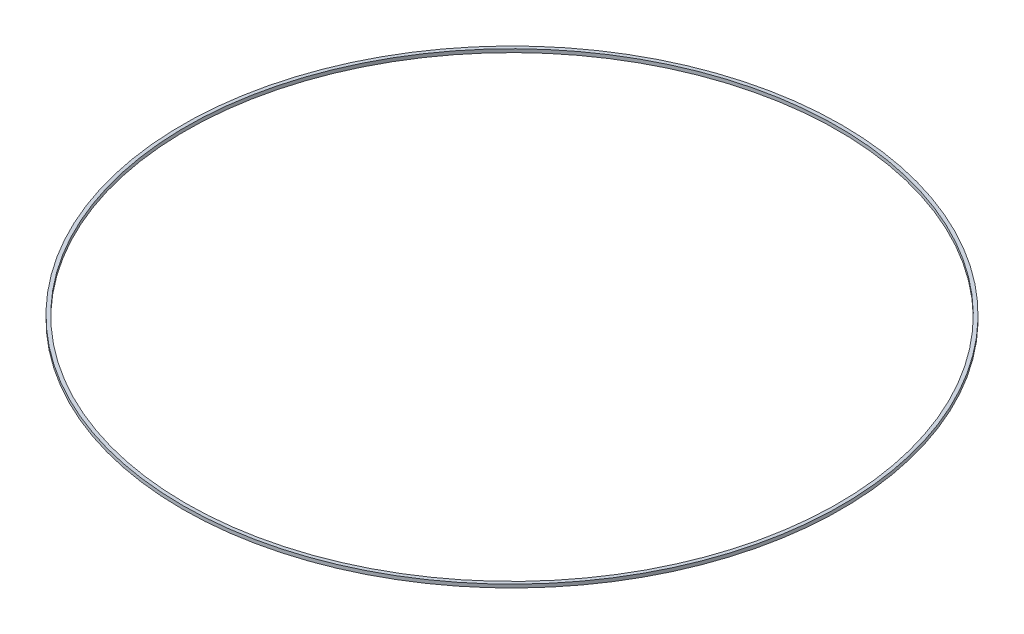
from build123d import *

# Parameters (mm, degrees)
SKETCH1_R           = 124.416473272
SKETCH1_R_2         = 123.146473272
BOSS_EXTRUDE1_DEPTH = 1.27


with BuildPart() as part:
    # Sketch1 → Boss-Extrude1 (new body)
    with BuildSketch(Plane(origin=(0, 0, 0), x_dir=(1, 0, 0), z_dir=(0, 1, 0))):
        with Locations(Location((0, 0, 0), (0, 0, 270))):
            Circle(SKETCH1_R)
        with Locations(Location((0, 0, 0), (0, 0, 270))):
            Circle(SKETCH1_R_2, mode=Mode.SUBTRACT)
    extrude(amount=BOSS_EXTRUDE1_DEPTH)


solid = part.part
